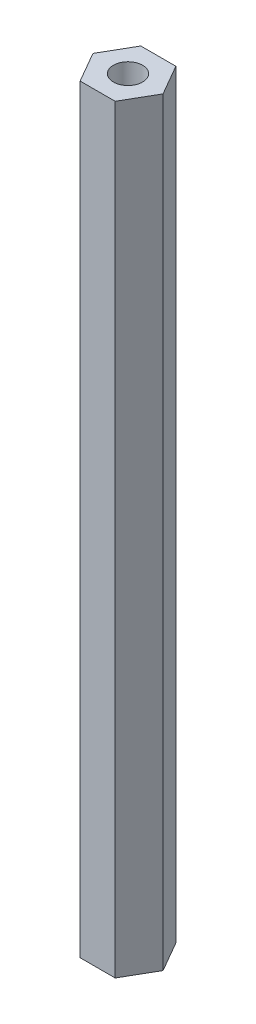
from build123d import *

# Parameters (mm, degrees)
EXTRUDE_1_DEPTH    = 65
HOLE_WIZARD_M3_1_D = 2.5


with BuildPart() as part:
    # 草图1 → 凸台-拉伸1 (new body)
    with BuildSketch(Plane(origin=(0, 0, 0), x_dir=(1, 0, 0), z_dir=(0, 1, 0))):
        Polygon((1.5, 2.598076211), (-1.5, 2.598076211), (-3, 0), (-1.5, -2.598076211), (1.5, -2.598076211), (3, 0), align=None)
    extrude(amount=EXTRUDE_1_DEPTH)

    # M3 螺纹孔1 (through all)
    with Locations(Plane(origin=(0, 65, 0), x_dir=(1, 0, 0), z_dir=(0, 1, 0))):
        with Locations((0, 0)):
            Hole(HOLE_WIZARD_M3_1_D / 2)


solid = part.part
